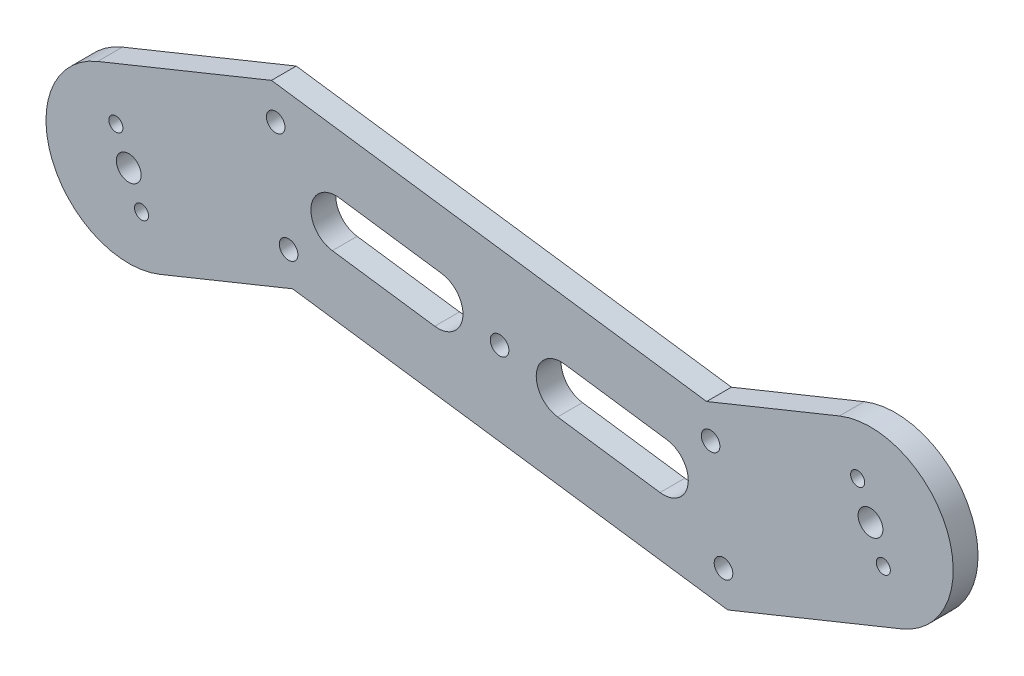
from build123d import *

# Parameters (mm, degrees)
SKETCH1_R                = 3
BOSS_EXTRUDE2_DEPTH      = 6
M4_CLEARANCE_HOLE1_D     = 4.5
M4_CLEARANCE_HOLE1_DEPTH = 84
M4_CLEARANCE_HOLE1_TIP   = 1.351936393
CUT_EXTRUDE1_DEPTH       = 203.576880123
M3_CLEARANCE_HOLE1_D     = 3.4


with BuildPart() as part:
    # Sketch1 → Boss-Extrude2 (new body)
    with BuildSketch(Plane.XY):
        with BuildLine():
            Line((139.718429351, 20.947970782), (171.818869964, 33.969557183))
            ThreePointArc((171.818869964, 33.969557183), (197.870084408, 22.954375569), (186.854902793, -3.096838875))
            Line((186.854902793, -3.096838875), (144.82255129, -20.147318131))
            Line((144.82255129, -20.147318131), (39.618457028, -5.511611627))
            Line((39.618457028, -5.511611627), (7.518016414, -18.533198029))
            ThreePointArc((7.518016414, -18.533198029), (-18.533198029, -7.518016414), (-7.518016414, 18.533198029))
            Line((-7.518016414, 18.533198029), (34.514335089, 35.583677285))
            Line((34.514335089, 35.583677285), (139.718429351, 20.947970782))
        make_face()
        with Locations((179.336886379, 15.436359154)):
            Circle(SKETCH1_R, mode=Mode.SUBTRACT)
        Circle(SKETCH1_R, mode=Mode.SUBTRACT)
    extrude(amount=BOSS_EXTRUDE2_DEPTH)

    # M4 Clearance Hole1
    with Locations(Plane(origin=(35.535159477, 27.364619503, 6), x_dir=(1, 0, 0), z_dir=(0, 0, 1))):
        with Locations((0, 0), (108.266567425, -39.292879851), (3.118996753, -25.112266952), (105.147570672, -14.1806129), (54.133283712, -19.646439926)):
            Hole(M4_CLEARANCE_HOLE1_D / 2, depth=M4_CLEARANCE_HOLE1_DEPTH)
            with Locations((0, 0, -(M4_CLEARANCE_HOLE1_DEPTH + M4_CLEARANCE_HOLE1_TIP / 2))):  # 118° drill point
                Cone(0, M4_CLEARANCE_HOLE1_D / 2, M4_CLEARANCE_HOLE1_TIP, mode=Mode.SUBTRACT)

    # Sketch5 → Cut-Extrude1 (cut, through all)
    with BuildSketch(Plane.XY.offset(6)):
        with BuildLine():
            Line((128.460158473, -3.736200604), (103.698622831, -0.291443337))
            ThreePointArc((103.698622831, -0.291443337), (98.582596021, 6.478066961), (105.352106319, 11.594093771))
            Line((105.352106319, 11.594093771), (130.113641961, 8.149336504))
            ThreePointArc((130.113641961, 8.149336504), (135.229668771, 1.379826206), (128.460158473, -3.736200604))
        make_face()
        with BuildLine():
            Line((73.98478006, 3.842265383), (49.223244417, 7.28702265))
            ThreePointArc((49.223244417, 7.28702265), (44.107217607, 14.056532949), (50.876727906, 19.172559759))
            Line((50.876727906, 19.172559759), (75.638263548, 15.727802492))
            ThreePointArc((75.638263548, 15.727802492), (80.754290358, 8.958292193), (73.98478006, 3.842265383))
        make_face()
    extrude(amount=-CUT_EXTRUDE1_DEPTH, mode=Mode.SUBTRACT)

    # M3 Clearance Hole1 (through all)
    with Locations(Plane(origin=(182.43806815, 7.791414967, 6), x_dir=(1, 0, 0), z_dir=(0, 0, 1))):
        with Locations((0, 0), (-6.202363542, 15.289888374), (-185.539249921, -0.14647078), (-179.336886379, -15.436359154)):
            Hole(M3_CLEARANCE_HOLE1_D / 2)


solid = part.part
